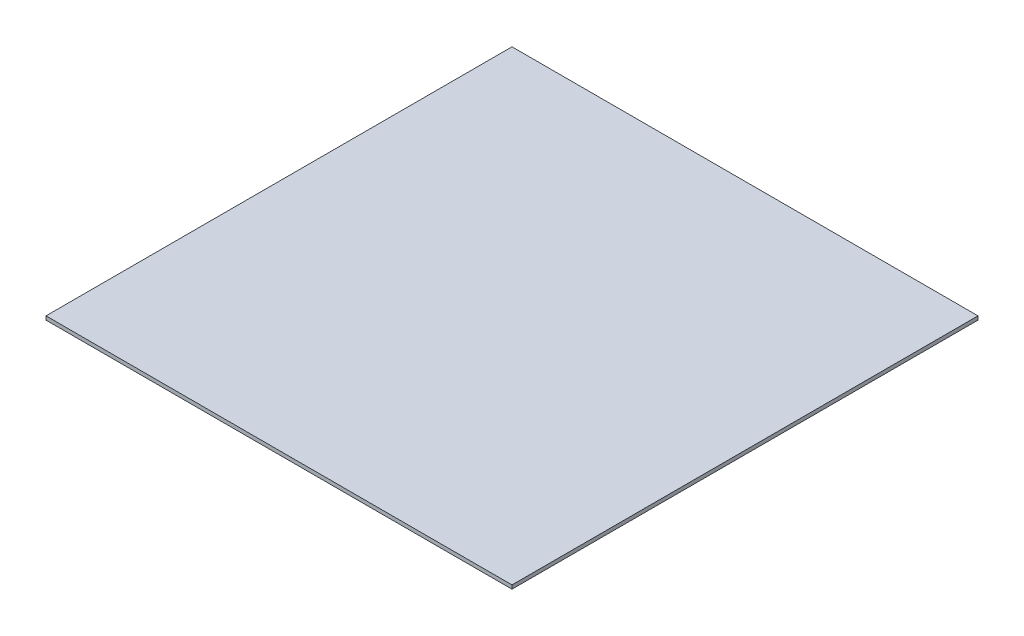
from build123d import *

# Parameters (mm, degrees)
ESQUISSE1_W        = 200
ESQUISSE1_H        = 200
BOSS_EXTRU_1_DEPTH = 1.6


with BuildPart() as part:
    # Esquisse1 → Boss.-Extru.1 (new body)
    with BuildSketch(Plane(origin=(0, 0, 0), x_dir=(1, 0, 0), z_dir=(0, 1, 0))):
        Rectangle(ESQUISSE1_W, ESQUISSE1_H)
    extrude(amount=BOSS_EXTRU_1_DEPTH)


solid = part.part
